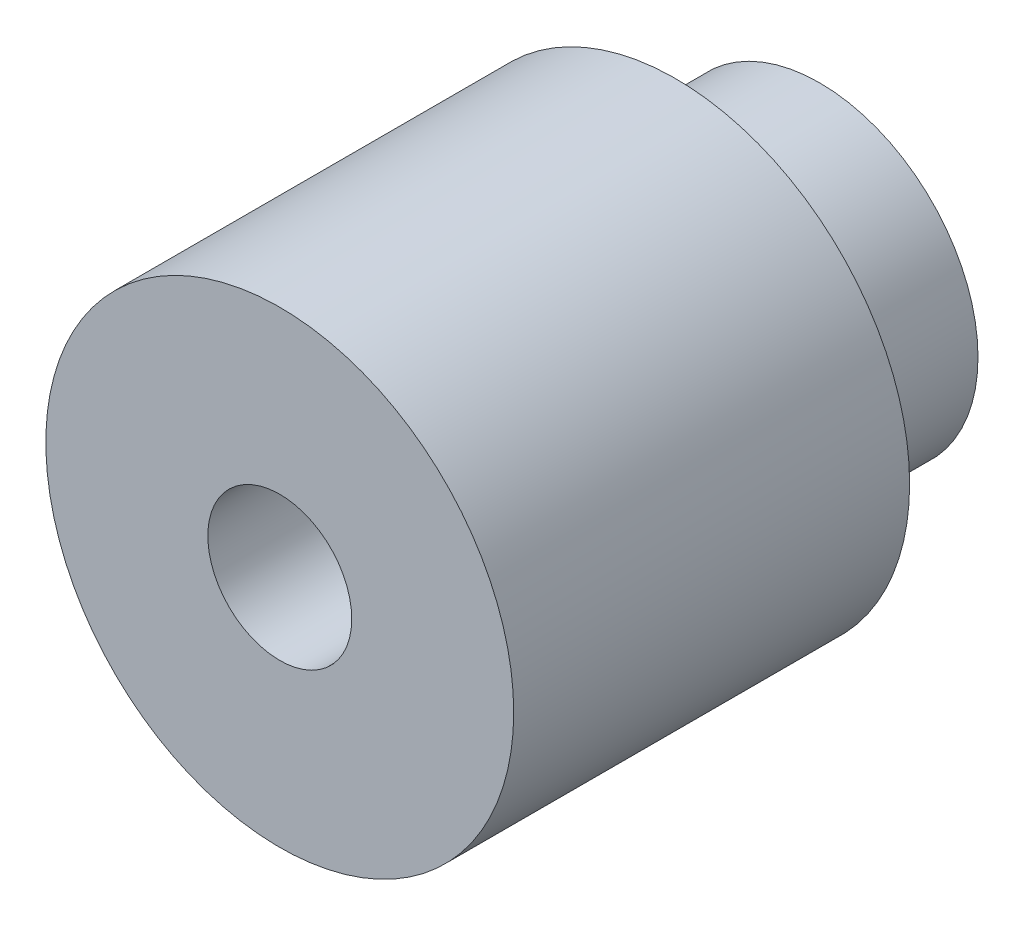
from build123d import *

# Parameters (mm, degrees)
RC_START                                     = -4
SKETCH1_R                                    = 4.4
SKETCH1_R_2                                  = 2
RC_1_8_CONNECTION_THREAD_CORE_ENVELOPE_DEPTH = 4
SKETCH2_R                                    = 6.5
SKETCH2_R_2                                  = 2
SHORT_FITTING_AND_TOOL_ACCESS_ENVELOPE_DEPTH = 11


with BuildPart() as part:
    # Sketch1 → Rc 1/8 connection, thread core envelope (new body)
    with BuildSketch(Plane.XY.offset(RC_START)):
        Circle(SKETCH1_R)
        Circle(SKETCH1_R_2, mode=Mode.SUBTRACT)
    extrude(amount=RC_1_8_CONNECTION_THREAD_CORE_ENVELOPE_DEPTH)

    # Sketch2 → Short fitting and tool access envelope (add)
    with BuildSketch(Plane.XY):
        Circle(SKETCH2_R)
        Circle(SKETCH2_R_2, mode=Mode.SUBTRACT)
    extrude(amount=SHORT_FITTING_AND_TOOL_ACCESS_ENVELOPE_DEPTH)


solid = part.part
